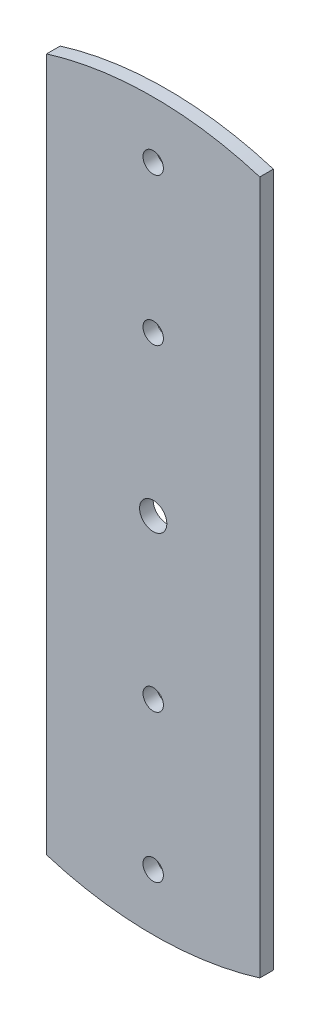
from build123d import *

# Parameters (mm, degrees)
SZKIC1_R                    = 6
SZKIC1_R_2                  = 4.5
DODANIE_WYCI_GNI_CIE1_DEPTH = 6


with BuildPart() as part:
    # Szkic1 → Dodanie-wyciągnięcie1 (new body)
    with BuildSketch(Plane.XY):
        with BuildLine():
            Line((-47, 152.941165158), (-47, -152.941165158))
            ThreePointArc((-47, -152.941165158), (0, -160), (47, -152.941165158))
            Line((47, -152.941165158), (47, 152.941165158))
            ThreePointArc((47, 152.941165158), (0, 160), (-47, 152.941165158))
        make_face()
        Circle(SZKIC1_R, mode=Mode.SUBTRACT)
        with Locations((0, -70)):
            Circle(SZKIC1_R_2, mode=Mode.SUBTRACT)
        with Locations((0, 70)):
            Circle(SZKIC1_R_2, mode=Mode.SUBTRACT)
        with Locations((0, 135)):
            Circle(SZKIC1_R_2, mode=Mode.SUBTRACT)
        with Locations((0, -135)):
            Circle(SZKIC1_R_2, mode=Mode.SUBTRACT)
    extrude(amount=DODANIE_WYCI_GNI_CIE1_DEPTH)


solid = part.part
